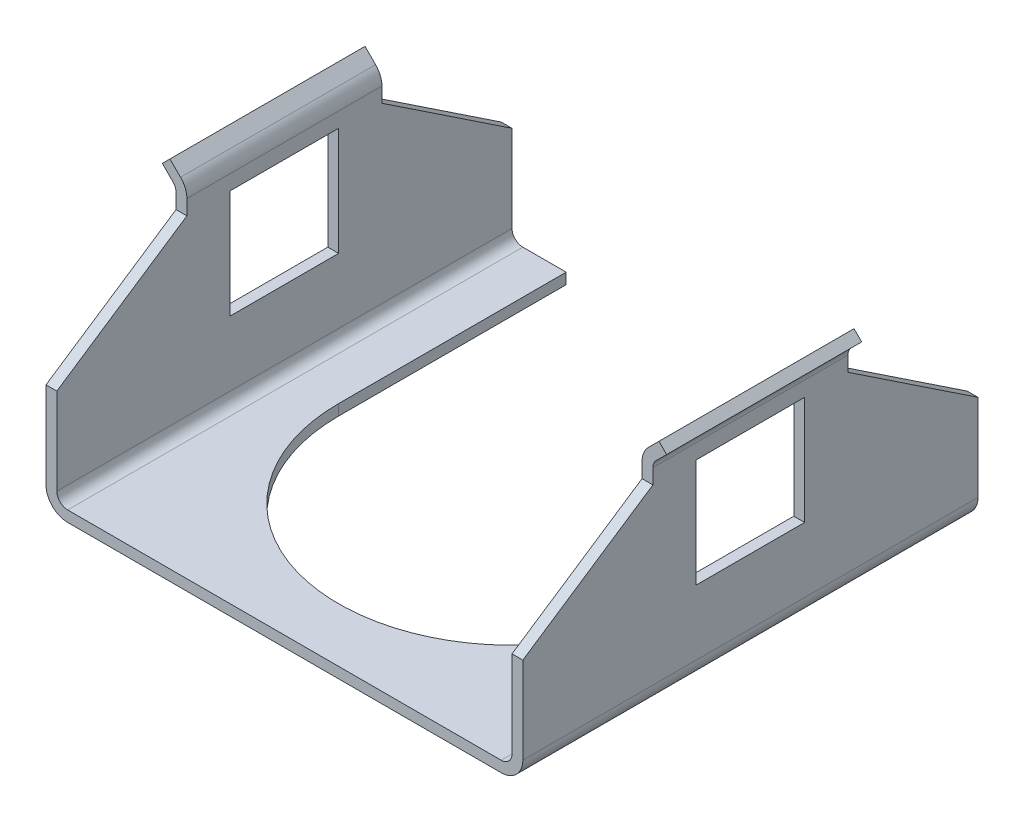
from build123d import *

# Parameters (mm, degrees)
SKETCH2_W               = 21
SKETCH2_H               = 21
SKETCH2_R               = 8
BOSS_EXTRUDE1_DEPTH     = 0.5
CUT_EXTRUDE1_START      = -1.5
CUT_EXTRUDE1_DEPTH      = 1.5
SKETCH4_W               = 21
SKETCH4_H               = 9
BOSS_EXTRUDE2_DEPTH     = 0.5
CUT_EXTRUDE2_DEPTH      = 26.563646062
CUT_EXTRUDE2_DEPTH_BACK = 26.563646062
SKETCH5_W               = 5
SKETCH5_H               = 5
CUT_EXTRUDE3_DEPTH      = 1.5
FILLET1_R               = 1
FILLET2_R               = 0.5
EXTRUDE_THIN1_DEPTH     = 4.5
FILLET3_R               = 0.5
FILLET4_R               = 1
CUT_EXTRUDE4_DEPTH      = 27.807046038
CUT_EXTRUDE4_DEPTH_BACK = 27.807046038
SKETCH8_W               = 5
SKETCH8_H               = 5
FILLET5_R               = 0.5
FILLET6_R               = 1


with BuildPart() as part:
    # Sketch2 → Boss-Extrude1 (new body)
    with BuildSketch(Plane(origin=(0, 0, 0), x_dir=(1, 0, 0), z_dir=(0, 1, 0))):
        Rectangle(SKETCH2_W, SKETCH2_H)
        with Locations(Location((0, 0, 0), (0, 0, 270))):
            Circle(SKETCH2_R, mode=Mode.SUBTRACT)
    extrude(amount=BOSS_EXTRUDE1_DEPTH)

    # Sketch3 → Cut-Extrude1 (cut)
    with BuildSketch(Plane(origin=(0, 0.5, 0), x_dir=(1, 0, 0), z_dir=(0, 1, 0)).offset(CUT_EXTRUDE1_START)):
        with BuildLine():
            Line((-8, 0), (-8, 10.5))
            Line((-8, 10.5), (-8, 11.595978523))
            Line((-8, 11.595978523), (8, 11.595978523))
            Line((8, 11.595978523), (8, 0))
            ThreePointArc((8, 0), (0, -8), (-8, 0))
        make_face()
    extrude(amount=CUT_EXTRUDE1_DEPTH, mode=Mode.SUBTRACT)

    # Sketch4 → Boss-Extrude2 (add)
    with BuildSketch(Plane(origin=(10.5, 0, 0), x_dir=(0, 0, -1), z_dir=(1, 0, 0))):
        with Locations((0, 4.5)):
            Rectangle(SKETCH4_W, SKETCH4_H)
    boss_extrude2 = extrude(amount=BOSS_EXTRUDE2_DEPTH)

    # Sketch5 → Cut-Extrude2 (cut, two sides: drawn at the far end of the back side and taken through both)
    with BuildSketch(Plane(origin=(11, 0, 0), x_dir=(0, 0, -1), z_dir=(1, 0, 0)).offset(-CUT_EXTRUDE2_DEPTH_BACK)):
        with Locations((0, 6.5)):
            Rectangle(SKETCH5_W, SKETCH5_H)
    extrude(amount=CUT_EXTRUDE2_DEPTH + CUT_EXTRUDE2_DEPTH_BACK, mode=Mode.SUBTRACT)

    # Sketch6 → Cut-Extrude3 (cut)
    with BuildSketch(Plane(origin=(11, 0, 0), x_dir=(0, 0, -1), z_dir=(1, 0, 0))):
        Polygon((10.5, 5), (4.5, 9), (4.5, 12.483472669), (11.734785125, 12.483472669), (11.734785125, 5), align=None)
    cut_extrude3 = extrude(amount=-CUT_EXTRUDE3_DEPTH, mode=Mode.SUBTRACT)

    # Mirror1: Cut-Extrude3 across plane
    add(cut_extrude3.mirror(Plane.XY), mode=Mode.SUBTRACT)

    # Fillet1
    fillet1_edges = [part.edges().sort_by_distance(p)[0] for p in [
        (11, 0, 0),
    ]]
    fillet(fillet1_edges, radius=FILLET1_R)

    # Fillet2
    fillet2_edges = [part.edges().sort_by_distance(p)[0] for p in [
        (10.5, 0.5, 0),
    ]]
    fillet(fillet2_edges, radius=FILLET2_R)

    # Sketch7 → Extrude-Thin1 (add, symmetric)
    with BuildSketch(Plane.XY):
        Polygon((11, 9), (11, 9.896446609), (11.633883476, 10.530330086), (11.280330086, 10.883883476), (10.5, 10.103553391), (10.5, 9), align=None)
    extrude_thin1 = extrude(amount=EXTRUDE_THIN1_DEPTH, both=True)

    # Fillet3
    fillet3_edges = [part.edges().sort_by_distance(p)[0] for p in [
        (11, 9.896446609, 0),
    ]]
    fillet(fillet3_edges, radius=FILLET3_R)

    # Fillet4
    fillet4_edges = [part.edges().sort_by_distance(p)[0] for p in [
        (10.5, 10.103553391, 0),
    ]]
    fillet(fillet4_edges, radius=FILLET4_R)

    # Mirror2: Boss-Extrude2, Extrude-Thin1 across plane
    add(boss_extrude2.mirror(Plane(origin=(0, 0, 0), x_dir=(0, 0, 1), z_dir=(1, 0, 0))))
    add(extrude_thin1.mirror(Plane(origin=(0, 0, 0), x_dir=(0, 0, 1), z_dir=(1, 0, 0))))

    # Sketch8 → Cut-Extrude4 (cut, two sides: drawn at the far end of the back side and taken through both)
    with BuildSketch(Plane(origin=(-10.5, 0, 0), x_dir=(0, 0, -1), z_dir=(1, 0, 0)).offset(-CUT_EXTRUDE4_DEPTH_BACK)):
        Polygon((4.5, 9), (4.5, 13.510449082), (11.904854474, 13.510449082), (11.904854474, 4.985722932), (10.5, 5), align=None)
        with Locations((0, 6.5)):
            Rectangle(SKETCH8_W, SKETCH8_H)
        Polygon((-10.5, 5), (-4.5, 9), (-4.5, 13.510449082), (-11.904854474, 13.510449082), (-11.904854474, 4.985722932), align=None)
    extrude(amount=CUT_EXTRUDE4_DEPTH + CUT_EXTRUDE4_DEPTH_BACK, mode=Mode.SUBTRACT)

    # Fillet5
    fillet5_edges = [part.edges().sort_by_distance(p)[0] for p in [
        (-10.5, 0.5, 0),
        (-11, 9.896446609, 0),
    ]]
    fillet(fillet5_edges, radius=FILLET5_R)

    # Fillet6
    fillet6_edges = [part.edges().sort_by_distance(p)[0] for p in [
        (-11, 0, 0),
        (-10.5, 10.103553391, 0),
    ]]
    fillet(fillet6_edges, radius=FILLET6_R)


solid = part.part
